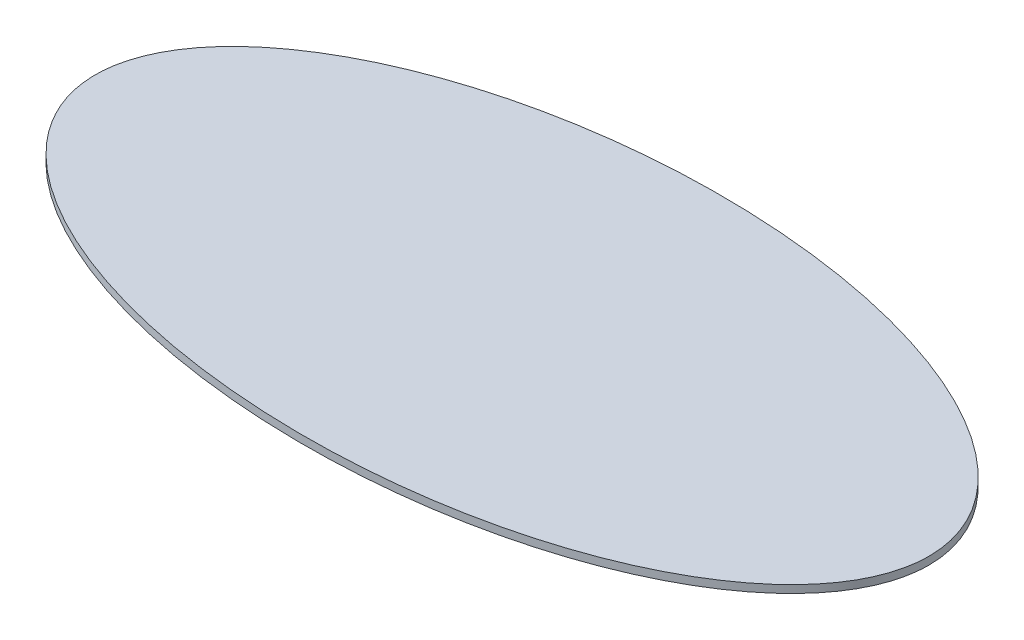
from build123d import *

# Parameters (mm, degrees)
SKETCH_1_RX     = 54
SKETCH_1_RY     = 27
EXTRUDE_1_DEPTH = 1


with BuildPart() as part:
    # 草图1 → 凸台-拉伸1 (new body)
    with BuildSketch(Plane(origin=(0, 0, 0), x_dir=(1, 0, 0), z_dir=(0, 1, 0))):
        with Locations((0, 0)):
            Ellipse(SKETCH_1_RX, SKETCH_1_RY)
    extrude(amount=EXTRUDE_1_DEPTH)


solid = part.part
